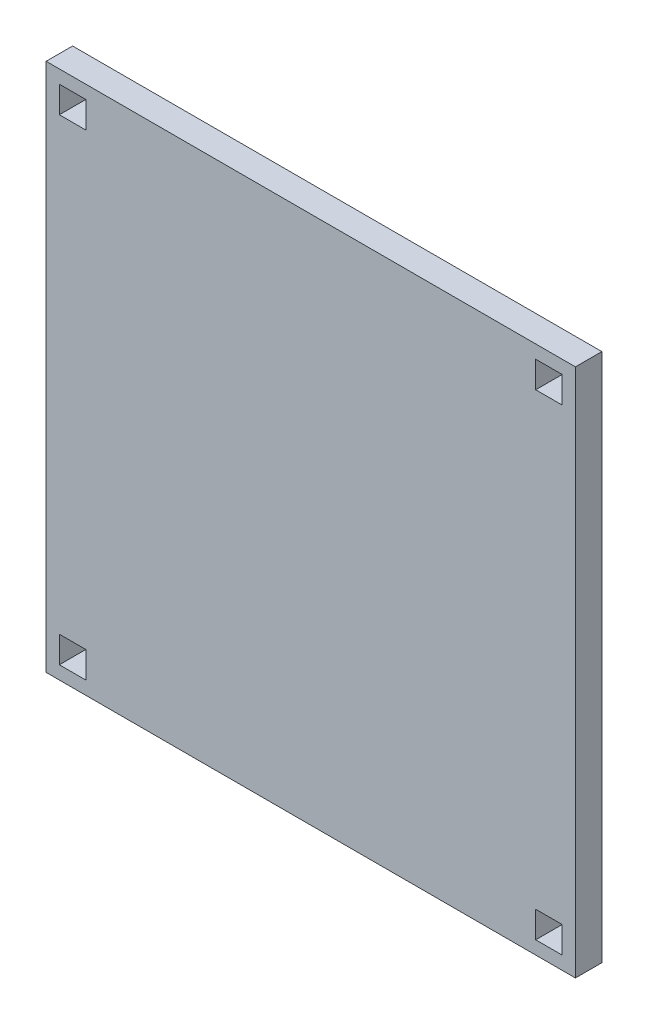
from build123d import *

# Parameters (mm, degrees)
SKETCH_1_W          = 1000
SKETCH_1_H          = 1000
EXTRUDE_1_DEPTH     = 50
SKETCH_2_W          = 50
SKETCH_2_H          = 50
CUT_EXTRUDE_1_DEPTH = 709.872343938
SKETCH_3_W          = 50
SKETCH_3_H          = 50
CUT_EXTRUDE_2_DEPTH = 709.872343938
SKETCH_4_W          = 50
SKETCH_4_H          = 50
CUT_EXTRUDE_3_DEPTH = 709.872343938
SKETCH_5_W          = 50
SKETCH_5_H          = 50
CUT_EXTRUDE_4_DEPTH = 709.872343938


with BuildPart() as part:
    # 草图1 → 凸台-拉伸1 (new body)
    with BuildSketch(Plane.XY):
        Rectangle(SKETCH_1_W, SKETCH_1_H)
    extrude(amount=EXTRUDE_1_DEPTH)

    # 草图2 → 切除-拉伸1 (cut, through all)
    with BuildSketch(Plane.XY):
        with Locations((450, 450)):
            Rectangle(SKETCH_2_W, SKETCH_2_H)
    extrude(amount=CUT_EXTRUDE_1_DEPTH, mode=Mode.SUBTRACT)

    # 草图3 → 切除-拉伸2 (cut, through all)
    with BuildSketch(Plane.XY):
        with Locations((-450, 450)):
            Rectangle(SKETCH_3_W, SKETCH_3_H)
    extrude(amount=CUT_EXTRUDE_2_DEPTH, mode=Mode.SUBTRACT)

    # 草图4 → 切除-拉伸3 (cut, through all)
    with BuildSketch(Plane.XY):
        with Locations((450, -450)):
            Rectangle(SKETCH_4_W, SKETCH_4_H)
    extrude(amount=CUT_EXTRUDE_3_DEPTH, mode=Mode.SUBTRACT)

    # 草图5 → 切除-拉伸4 (cut, through all)
    with BuildSketch(Plane.XY):
        with Locations((-450, -450)):
            Rectangle(SKETCH_5_W, SKETCH_5_H)
    extrude(amount=CUT_EXTRUDE_4_DEPTH, mode=Mode.SUBTRACT)


solid = part.part
